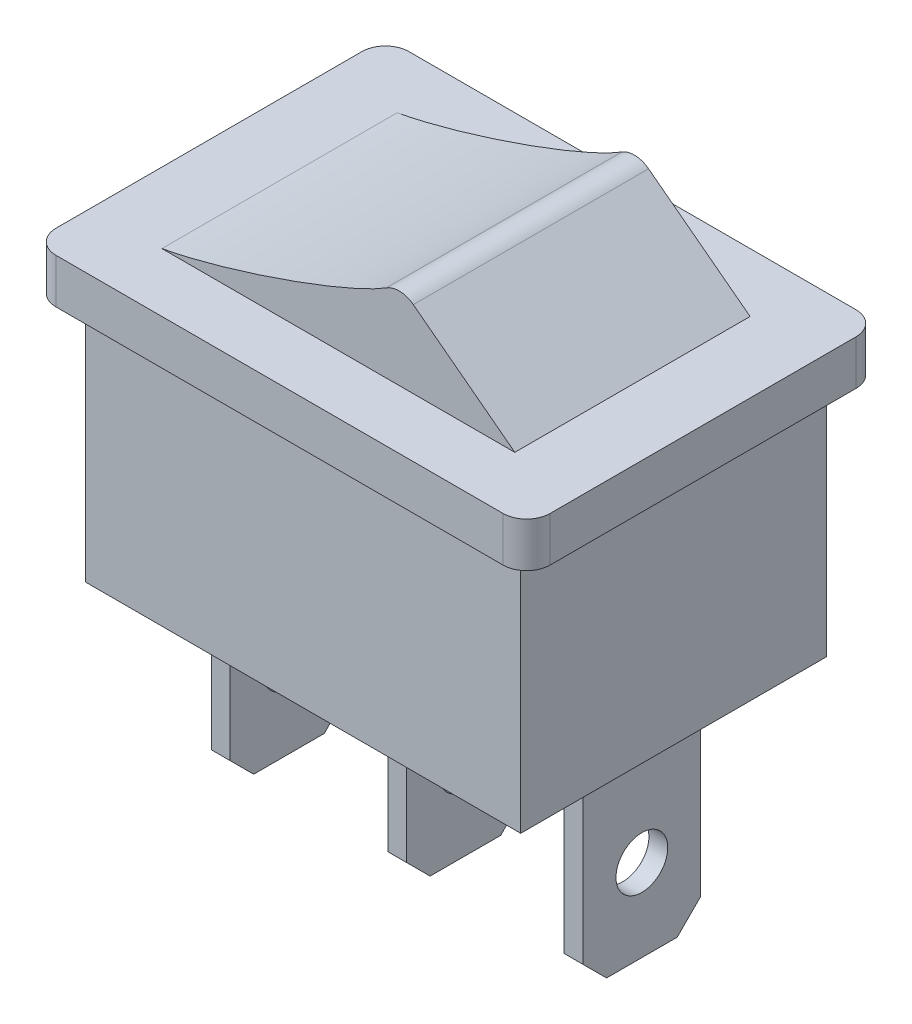
from build123d import *

# Parameters (mm, degrees)
SKETCH1_W           = 21
SKETCH1_H           = 15
BOSS_EXTRUDE1_DEPTH = 1.9
FILLET1_R           = 1
SKETCH2_W           = 18.5
SKETCH2_H           = 13
BOSS_EXTRUDE2_DEPTH = 10.5
BOSS_EXTRUDE3_START = -6.5
BOSS_EXTRUDE3_DEPTH = 5
FILLET2_R           = 1
SKETCH5_W           = 0.8
SKETCH5_H           = 5
BOSS_EXTRUDE4_DEPTH = 8.5
CHAMFER1_SIZE       = 1
SKETCH6_R           = 1.1
CUT_EXTRUDE1_DEPTH  = 28.491998836


with BuildPart() as part:
    # Sketch1 → Boss-Extrude1 (new body)
    with BuildSketch(Plane(origin=(0, 0, 0), x_dir=(1, 0, 0), z_dir=(0, 1, 0))):
        Rectangle(SKETCH1_W, SKETCH1_H)
    extrude(amount=BOSS_EXTRUDE1_DEPTH)

    # Fillet1
    fillet1_edges = [part.edges().sort_by_distance(p)[0] for p in [
        (10.5, 0.95, 7.5),
        (-10.5, 0.95, 7.5),
        (-10.5, 0.95, -7.5),
        (10.5, 0.95, -7.5),
    ]]
    fillet(fillet1_edges, radius=FILLET1_R)

    # Sketch2 → Boss-Extrude2 (add)
    with BuildSketch(Plane.XZ):
        Rectangle(SKETCH2_W, SKETCH2_H)
    extrude(amount=BOSS_EXTRUDE2_DEPTH)

    # Sketch4 → Boss-Extrude3 (add, symmetric)
    with BuildSketch(Plane(origin=(0, 0, -6.5), x_dir=(-1, 0, 0), z_dir=(0, 0, -1)).offset(BOSS_EXTRUDE3_START)):
        with BuildLine():
            Line((-7.5, 1.9), (7.5, 1.9))
            add(Edge.make_bspline(
                [(-2.5, 5.7), (-3.131503611, 3.8), (7.5, 1.9)],
                knots=[0, 0, 0, 2.456334169, 2.456334169, 2.456334169], degree=2, weights=[1, 0.335964667, 1]))
            Line((-2.5, 5.7), (-7.5, 1.9))
        make_face()
    extrude(amount=BOSS_EXTRUDE3_DEPTH, both=True)

    # Fillet2
    fillet2_edges = [part.edges().sort_by_distance(p)[0] for p in [
        (2.5, 5.7, -2.5),
    ]]
    fillet(fillet2_edges, radius=FILLET2_R)

    # Sketch5 → Boss-Extrude4 (add)
    with BuildSketch(Plane.XZ.offset(10.5)):
        with Locations((7.5, 0)):
            Rectangle(SKETCH5_W, SKETCH5_H)
        Rectangle(SKETCH5_W, SKETCH5_H)
        with Locations((-7.5, 0)):
            Rectangle(SKETCH5_W, SKETCH5_H)
    extrude(amount=BOSS_EXTRUDE4_DEPTH)

    # Chamfer1
    chamfer1_edges = [part.edges().sort_by_distance(p)[0] for p in [
        (0, -19, 2.5),
        (0, -19, -2.5),
        (7.5, -19, 2.5),
        (7.5, -19, -2.5),
        (-7.5, -19, 2.5),
        (-7.5, -19, -2.5),
    ]]
    chamfer(chamfer1_edges, length=CHAMFER1_SIZE)

    # Sketch6 → Cut-Extrude1 (cut, through all)
    with BuildSketch(Plane.ZY.offset(7.9)):
        with Locations((0, -15.5)):
            Circle(SKETCH6_R)
    extrude(amount=-CUT_EXTRUDE1_DEPTH, mode=Mode.SUBTRACT)


solid = part.part
